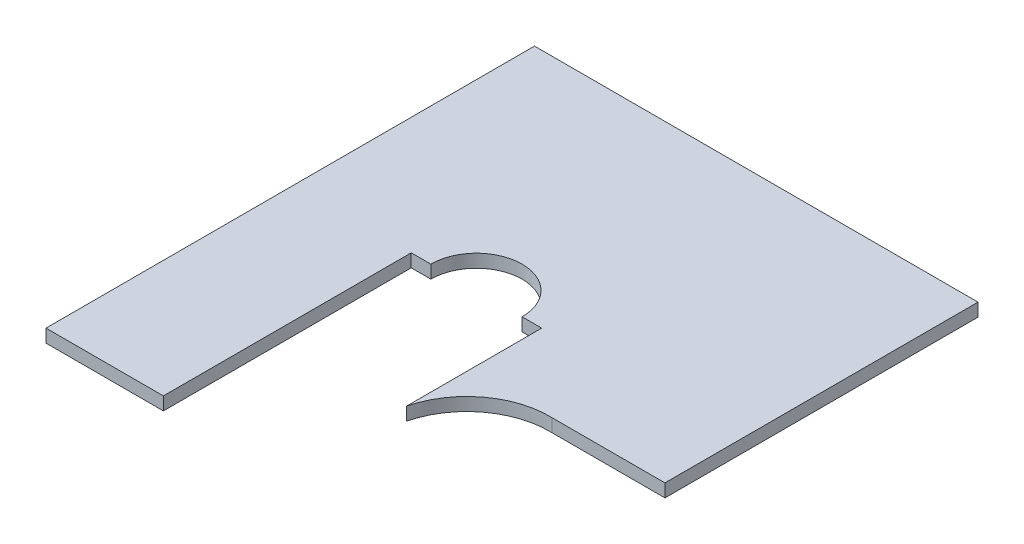
from build123d import *

# Parameters (mm, degrees)
BOSS_EXTRUDE1_DEPTH = 0.25


with BuildPart() as part:
    # Sketch1 → Boss-Extrude1 (new, symmetric)
    with BuildSketch(Plane(origin=(0, 0, 0), x_dir=(1, 0, 0), z_dir=(0, 1, 0))):
        with BuildLine():
            Line((1.977113733, 26.118743762), (1.977113733, 38.118743762))
            Line((1.977113733, 38.118743762), (-15.022886267, 38.118743762))
            Line((-15.022886267, 38.118743762), (-15.022886267, 19.393587035))
            Line((-15.022886267, 19.393587035), (-10.522886267, 19.393587035))
            Line((-10.522886267, 19.393587035), (-10.522886267, 28.893587035))
            Line((-10.522886267, 28.893587035), (-9.772886267, 28.893587035))
            ThreePointArc((-9.772886267, 28.893587035), (-8.022886267, 30.643587035), (-6.272886267, 28.893587035))
            Line((-6.272886267, 28.893587035), (-5.522886267, 28.893587035))
            Line((-5.522886267, 28.893587035), (-5.522886267, 23.718587035))
            ThreePointArc((-5.522886267, 23.718587035), (-4.358162581, 25.477926708), (-2.347886267, 26.118743762))
            Line((-2.347886267, 26.118743762), (1.977113733, 26.118743762))
        make_face()
    extrude(amount=BOSS_EXTRUDE1_DEPTH, both=True)


solid = part.part
